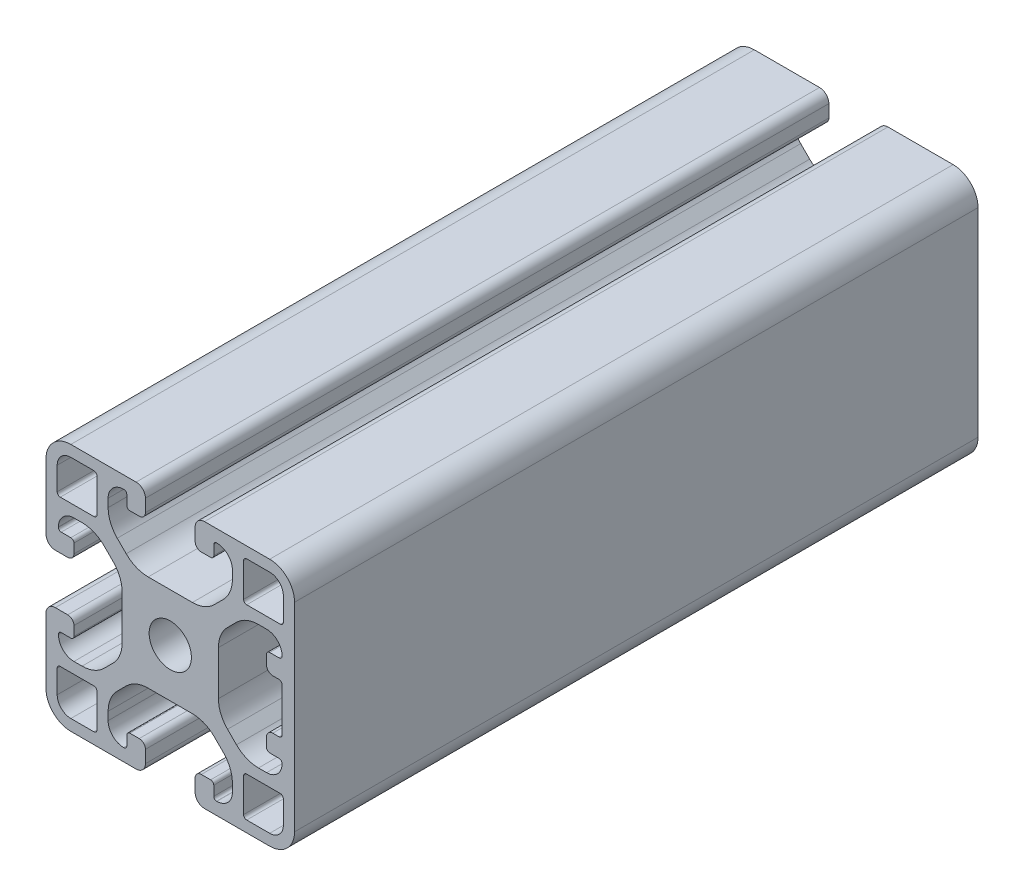
from build123d import *

# Parameters (mm, degrees)
SCHIZZO1_R                   = 3.4
ESTRUSIONE_ESTRUSIONE1_DEPTH = 110


with BuildPart() as part:
    # Schizzo1 → Estrusione-Estrusione1 (new body)
    with BuildSketch(Plane(origin=(0, 0, -340), x_dir=(-1, 0, 0), z_dir=(0, 0, -1))):
        with BuildLine():
            Line((6.5, -15.5), (5, -15.5))
            ThreePointArc((5, -15.5), (4.292893219, -15.792893219), (4, -16.5))
            Line((4, -16.5), (4, -18.5))
            ThreePointArc((4, -18.5), (4.439339828, -19.560660172), (5.5, -20))
            Line((5.5, -20), (16, -20))
            ThreePointArc((16, -20), (18.828427125, -18.828427125), (20, -16))
            Line((20, -16), (20, -5.5))
            ThreePointArc((20, -5.5), (19.560660172, -4.439339828), (18.5, -4))
            Line((18.5, -4), (16.5, -4))
            ThreePointArc((16.5, -4), (15.792893219, -4.292893219), (15.5, -5))
            Line((15.5, -5), (15.5, -6.5))
            ThreePointArc((15.5, -6.5), (15.646446609, -6.853553391), (16, -7))
            Line((16, -7), (17.55, -7))
            ThreePointArc((17.55, -7), (17.868198052, -7.131801948), (18, -7.45))
            Line((18, -7.45), (18, -7.5))
            ThreePointArc((18, -7.5), (17.267766953, -9.267766953), (15.5, -10))
            Line((15.5, -10), (14.192388155, -10))
            ThreePointArc((14.192388155, -10), (12.278970994, -9.619397663), (10.656854249, -8.535533906))
            Line((10.656854249, -8.535533906), (9.214466094, -7.09314575))
            ThreePointArc((9.214466094, -7.09314575), (8.130602337, -5.471029006), (7.75, -3.557611845))
            Line((7.75, -3.557611845), (7.75, 3.557611845))
            ThreePointArc((7.75, 3.557611845), (8.130602337, 5.471029006), (9.214466094, 7.09314575))
            Line((9.214466094, 7.09314575), (10.656854249, 8.535533906))
            ThreePointArc((10.656854249, 8.535533906), (12.278970994, 9.619397663), (14.192388155, 10))
            Line((14.192388155, 10), (15.5, 10))
            ThreePointArc((15.5, 10), (17.267766953, 9.267766953), (18, 7.5))
            Line((18, 7.5), (18, 7.45))
            ThreePointArc((18, 7.45), (17.868198052, 7.131801948), (17.55, 7))
            Line((17.55, 7), (16, 7))
            ThreePointArc((16, 7), (15.646446609, 6.853553391), (15.5, 6.5))
            Line((15.5, 6.5), (15.5, 5))
            ThreePointArc((15.5, 5), (15.792893219, 4.292893219), (16.5, 4))
            Line((16.5, 4), (18.5, 4))
            ThreePointArc((18.5, 4), (19.560660172, 4.439339828), (20, 5.5))
            Line((20, 5.5), (20, 16))
            ThreePointArc((20, 16), (18.828427125, 18.828427125), (16, 20))
            Line((16, 20), (5.5, 20))
            ThreePointArc((5.5, 20), (4.439339828, 19.560660172), (4, 18.5))
            Line((4, 18.5), (4, 16.5))
            ThreePointArc((4, 16.5), (4.292893219, 15.792893219), (5, 15.5))
            Line((5, 15.5), (6.5, 15.5))
            ThreePointArc((6.5, 15.5), (6.853553391, 15.646446609), (7, 16))
            Line((7, 16), (7, 17.55))
            ThreePointArc((7, 17.55), (7.131801948, 17.868198052), (7.45, 18))
            Line((7.45, 18), (7.5, 18))
            ThreePointArc((7.5, 18), (9.267766953, 17.267766953), (10, 15.5))
            Line((10, 15.5), (10, 14.192388155))
            ThreePointArc((10, 14.192388155), (9.619397663, 12.278970994), (8.535533906, 10.656854249))
            Line((8.535533906, 10.656854249), (7.09314575, 9.214466094))
            ThreePointArc((7.09314575, 9.214466094), (5.471029006, 8.130602337), (3.557611844, 7.75))
            Line((3.557611844, 7.75), (-3.557611845, 7.75))
            ThreePointArc((-3.557611845, 7.75), (-5.471029006, 8.130602337), (-7.09314575, 9.214466094))
            Line((-7.09314575, 9.214466094), (-8.535533906, 10.656854249))
            ThreePointArc((-8.535533906, 10.656854249), (-9.619397663, 12.278970994), (-10, 14.192388155))
            Line((-10, 14.192388155), (-10, 15.5))
            ThreePointArc((-10, 15.5), (-9.267766953, 17.267766953), (-7.5, 18))
            Line((-7.5, 18), (-7.45, 18))
            ThreePointArc((-7.45, 18), (-7.131801948, 17.868198052), (-7, 17.55))
            Line((-7, 17.55), (-7, 16))
            ThreePointArc((-7, 16), (-6.853553391, 15.646446609), (-6.5, 15.5))
            Line((-6.5, 15.5), (-5, 15.5))
            ThreePointArc((-5, 15.5), (-4.292893219, 15.792893219), (-4, 16.5))
            Line((-4, 16.5), (-4, 18.5))
            ThreePointArc((-4, 18.5), (-4.439339828, 19.560660172), (-5.5, 20))
            Line((-5.5, 20), (-16, 20))
            ThreePointArc((-16, 20), (-18.828427125, 18.828427125), (-20, 16))
            Line((-20, 16), (-20, -16))
            ThreePointArc((-20, -16), (-18.828427125, -18.828427125), (-16, -20))
            Line((-16, -20), (-5.5, -20))
            ThreePointArc((-5.5, -20), (-4.439339828, -19.560660172), (-4, -18.5))
            Line((-4, -18.5), (-4, -16.5))
            ThreePointArc((-4, -16.5), (-4.292893219, -15.792893219), (-5, -15.5))
            Line((-5, -15.5), (-6.5, -15.5))
            ThreePointArc((-6.5, -15.5), (-6.853553391, -15.646446609), (-7, -16))
            Line((-7, -16), (-7, -17.55))
            ThreePointArc((-7, -17.55), (-7.131801948, -17.868198052), (-7.45, -18))
            Line((-7.45, -18), (-7.5, -18))
            ThreePointArc((-7.5, -18), (-9.267766953, -17.267766953), (-10, -15.5))
            Line((-10, -15.5), (-10, -14.192388155))
            ThreePointArc((-10, -14.192388155), (-9.619397663, -12.278970994), (-8.535533906, -10.656854249))
            Line((-8.535533906, -10.656854249), (-7.09314575, -9.214466094))
            ThreePointArc((-7.09314575, -9.214466094), (-5.471029006, -8.130602337), (-3.557611845, -7.75))
            Line((-3.557611845, -7.75), (3.557611845, -7.75))
            ThreePointArc((3.557611845, -7.75), (5.471029006, -8.130602337), (7.09314575, -9.214466094))
            Line((7.09314575, -9.214466094), (8.535533906, -10.656854249))
            ThreePointArc((8.535533906, -10.656854249), (9.619397663, -12.278970994), (10, -14.192388155))
            Line((10, -14.192388155), (10, -15.5))
            ThreePointArc((10, -15.5), (9.267766953, -17.267766953), (7.5, -18))
            Line((7.5, -18), (7.45, -18))
            ThreePointArc((7.45, -18), (7.131801948, -17.868198052), (7, -17.55))
            Line((7, -17.55), (7, -16))
            ThreePointArc((7, -16), (6.853553391, -15.646446609), (6.5, -15.5))
        make_face()
        with Locations(Location((0, 0, 0), (0, 0, 180))):
            Circle(SCHIZZO1_R, mode=Mode.SUBTRACT)
        with BuildLine():
            Line((-12.3, -18.2), (-16, -18.2))
            ThreePointArc((-16, -18.2), (-17.555634919, -17.555634919), (-18.2, -16))
            Line((-18.2, -16), (-18.2, -12.3))
            ThreePointArc((-18.2, -12.3), (-18.053553391, -11.946446609), (-17.7, -11.8))
            Line((-17.7, -11.8), (-12.3, -11.8))
            ThreePointArc((-12.3, -11.8), (-11.946446609, -11.946446609), (-11.8, -12.3))
            Line((-11.8, -12.3), (-11.8, -17.7))
            ThreePointArc((-11.8, -17.7), (-11.946446609, -18.053553391), (-12.3, -18.2))
        make_face(mode=Mode.SUBTRACT)
        with BuildLine():
            Line((-11.8, 17.7), (-11.8, 12.3))
            ThreePointArc((-11.8, 12.3), (-11.946446609, 11.946446609), (-12.3, 11.8))
            Line((-12.3, 11.8), (-17.7, 11.8))
            ThreePointArc((-17.7, 11.8), (-18.053553391, 11.946446609), (-18.2, 12.3))
            Line((-18.2, 12.3), (-18.2, 16))
            ThreePointArc((-18.2, 16), (-17.555634919, 17.555634919), (-16, 18.2))
            Line((-16, 18.2), (-12.3, 18.2))
            ThreePointArc((-12.3, 18.2), (-11.946446609, 18.053553391), (-11.8, 17.7))
        make_face(mode=Mode.SUBTRACT)
        with BuildLine():
            Line((18.2, 16), (18.2, 12.3))
            ThreePointArc((18.2, 12.3), (18.053553391, 11.946446609), (17.7, 11.8))
            Line((17.7, 11.8), (12.3, 11.8))
            ThreePointArc((12.3, 11.8), (11.946446609, 11.946446609), (11.8, 12.3))
            Line((11.8, 12.3), (11.8, 17.7))
            ThreePointArc((11.8, 17.7), (11.946446609, 18.053553391), (12.3, 18.2))
            Line((12.3, 18.2), (16, 18.2))
            ThreePointArc((16, 18.2), (17.555634919, 17.555634919), (18.2, 16))
        make_face(mode=Mode.SUBTRACT)
        with BuildLine():
            Line((18.2, -12.3), (18.2, -16))
            ThreePointArc((18.2, -16), (17.555634919, -17.555634919), (16, -18.2))
            Line((16, -18.2), (12.3, -18.2))
            ThreePointArc((12.3, -18.2), (11.946446609, -18.053553391), (11.8, -17.7))
            Line((11.8, -17.7), (11.8, -12.3))
            ThreePointArc((11.8, -12.3), (11.946446609, -11.946446609), (12.3, -11.8))
            Line((12.3, -11.8), (17.7, -11.8))
            ThreePointArc((17.7, -11.8), (18.053553391, -11.946446609), (18.2, -12.3))
        make_face(mode=Mode.SUBTRACT)
        with BuildLine():
            Line((-16, 7), (-17.5, 7))
            ThreePointArc((-17.5, 7), (-17.853553391, 7.146446609), (-18, 7.5))
            ThreePointArc((-18, 7.5), (-17.267766953, 9.267766953), (-15.5, 10))
            Line((-15.5, 10), (-14.192388155, 10))
            ThreePointArc((-14.192388155, 10), (-12.278970994, 9.619397663), (-10.656854249, 8.535533906))
            Line((-10.656854249, 8.535533906), (-9.214466094, 7.093145751))
            ThreePointArc((-9.214466094, 7.093145751), (-8.130602337, 5.471029006), (-7.75, 3.557611845))
            Line((-7.75, 3.557611845), (-7.75, -3.557611845))
            ThreePointArc((-7.75, -3.557611845), (-8.130602337, -5.471029006), (-9.214466094, -7.093145751))
            Line((-9.214466094, -7.093145751), (-10.656854249, -8.535533906))
            ThreePointArc((-10.656854249, -8.535533906), (-12.278970994, -9.619397663), (-14.192388155, -10))
            Line((-14.192388155, -10), (-15.5, -10))
            ThreePointArc((-15.5, -10), (-17.267766953, -9.267766953), (-18, -7.5))
            ThreePointArc((-18, -7.5), (-17.853553391, -7.146446609), (-17.5, -7))
            Line((-17.5, -7), (-16, -7))
            ThreePointArc((-16, -7), (-15.646446609, -6.853553391), (-15.5, -6.5))
            Line((-15.5, -6.5), (-15.5, -5))
            ThreePointArc((-15.5, -5), (-15.792893219, -4.292893219), (-16.5, -4))
            Line((-16.5, -4), (-17.5, -4))
            ThreePointArc((-17.5, -4), (-17.853553391, -3.853553391), (-18, -3.5))
            Line((-18, -3.5), (-18, 3.5))
            ThreePointArc((-18, 3.5), (-17.853553391, 3.853553391), (-17.5, 4))
            Line((-17.5, 4), (-16.5, 4))
            ThreePointArc((-16.5, 4), (-15.792893219, 4.292893219), (-15.5, 5))
            Line((-15.5, 5), (-15.5, 6.5))
            ThreePointArc((-15.5, 6.5), (-15.646446609, 6.853553391), (-16, 7))
        make_face(mode=Mode.SUBTRACT)
    extrude(amount=-ESTRUSIONE_ESTRUSIONE1_DEPTH)


solid = part.part
